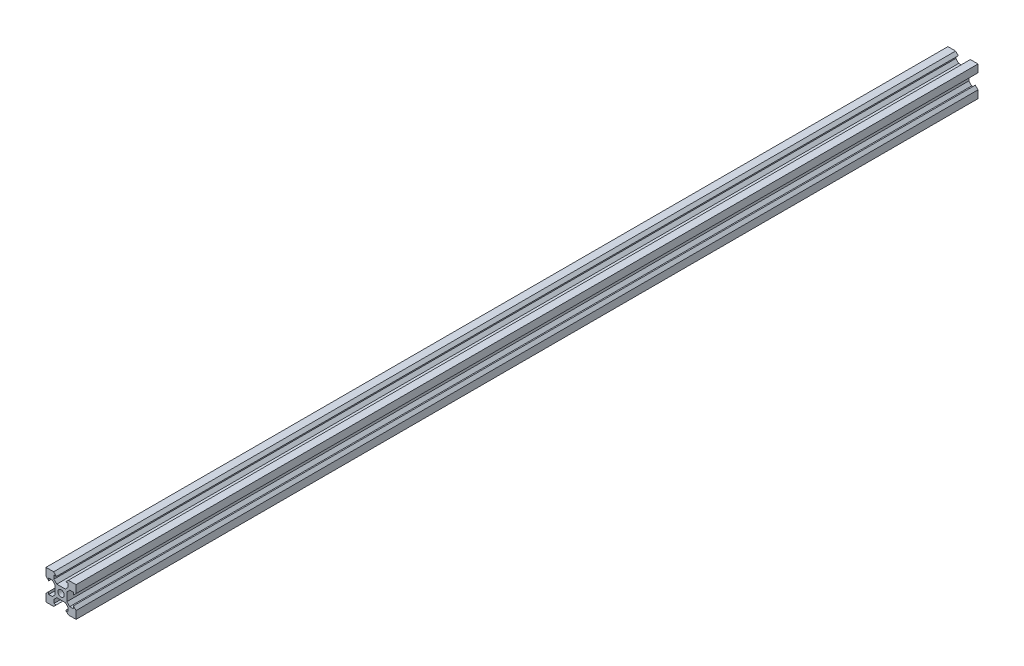
from build123d import *

# Parameters (mm, degrees)
SKETCH1_R           = 2.1
BOSS_EXTRUDE1_DEPTH = 300


with BuildPart() as part:
    # Sketch1 → Boss-Extrude1 (new, symmetric)
    with BuildSketch(Plane.XY):
        Polygon((-3.900660172, -2.84), (-3.900660172, 2.84), (-5.800660172, 4.74), (-8.2, 4.74), (-8.2, 3.1), (-10, 4.9), (-10, 10), (-4.9, 10), (-3.1, 8.2), (-4.74, 8.2), (-4.74, 5.800660172), (-2.84, 3.900660172), (0, 3.900660172), (2.84, 3.900660172), (4.74, 5.800660172), (4.74, 8.2), (3.1, 8.2), (4.9, 10), (10, 10), (10, 4.9), (8.2, 3.1), (8.2, 4.74), (5.800660172, 4.74), (3.900660172, 2.84), (3.900660172, -2.84), (5.800660172, -4.74), (8.2, -4.74), (8.2, -3.1), (10, -4.9), (10, -10), (4.9, -10), (3.1, -8.2), (4.74, -8.2), (4.74, -5.800660172), (2.84, -3.900660172), (0, -3.900660172), (-2.84, -3.900660172), (-4.74, -5.800660172), (-4.74, -8.2), (-3.1, -8.2), (-4.9, -10), (-10, -10), (-10, -4.9), (-8.2, -3.1), (-8.2, -4.74), (-5.800660172, -4.74), align=None)
        Circle(SKETCH1_R, mode=Mode.SUBTRACT)
    extrude(amount=BOSS_EXTRUDE1_DEPTH, both=True)


solid = part.part
